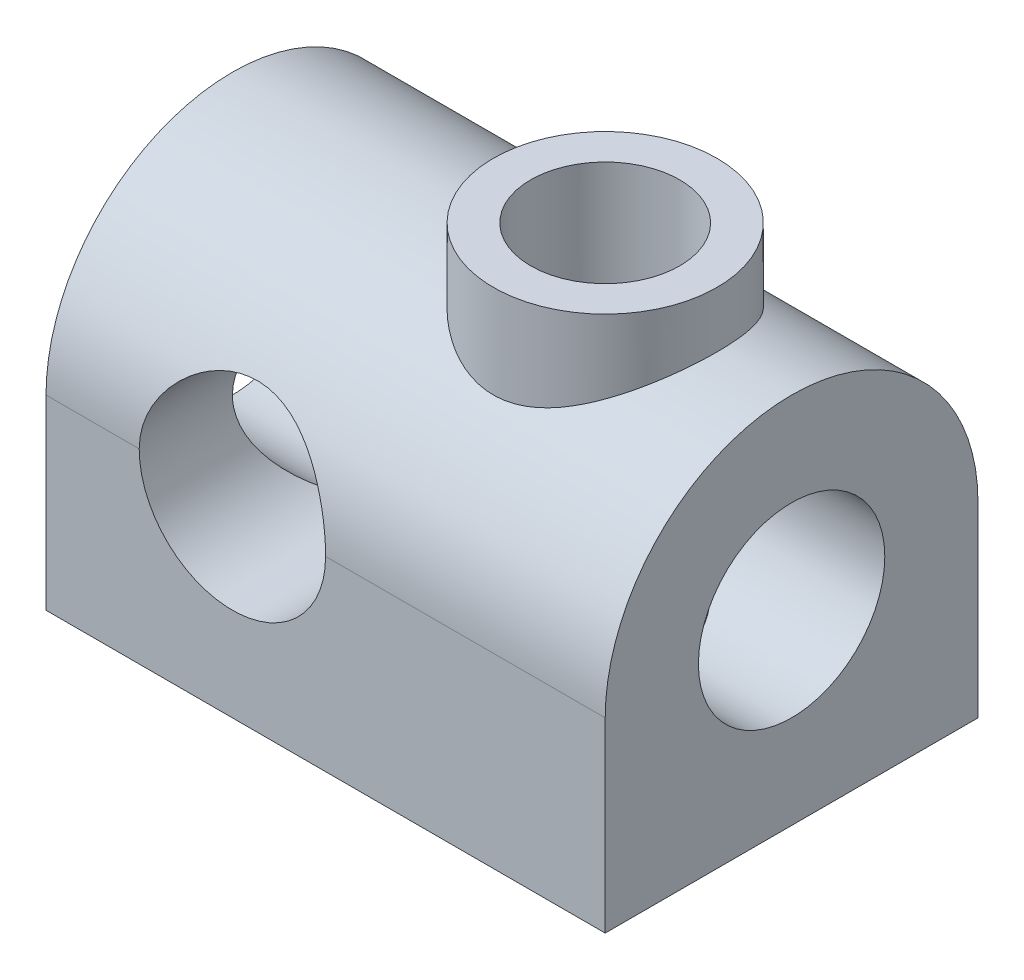
from build123d import *

# Parameters (mm, degrees)
EXTRUDE_1_DEPTH     = 60
SKETCH_3_R          = 12
EXTRUDE_2_DEPTH     = 46
SKETCH_6_R          = 10
CUT_EXTRUDE_1_DEPTH = 69.381284144
SKETCH_7_R          = 8
CUT_EXTRUDE_2_DEPTH = 79.204859286
SKETCH_8_R          = 10
CUT_EXTRUDE_3_DEPTH = 77.655071751


with BuildPart() as part:
    # 草图1 → 凸台-拉伸1 (new body)
    with BuildSketch(Plane(origin=(0, 0, 0), x_dir=(0, 0, -1), z_dir=(1, 0, 0))):
        with BuildLine():
            Line((-20, 0), (-20, -20))
            Line((-20, -20), (20, -20))
            Line((20, -20), (20, 0))
            ThreePointArc((20, 0), (0, 20), (-20, 0))
        make_face()
    extrude(amount=EXTRUDE_1_DEPTH)

    # 草图3 → 凸台-拉伸2 (add)
    with BuildSketch(Plane(origin=(0, -20, 0), x_dir=(-1, 0, 0), z_dir=(0, -1, 0))):
        with Locations(Location((-40, 0, 0), (0, 0, 90))):
            Circle(SKETCH_3_R)
    extrude(amount=-EXTRUDE_2_DEPTH)

    # 草图6 → 切除-拉伸1 (cut, through all)
    with BuildSketch(Plane.ZY):
        Circle(SKETCH_6_R)
    extrude(amount=-CUT_EXTRUDE_1_DEPTH, mode=Mode.SUBTRACT)

    # 草图7 → 切除-拉伸2 (cut, through all)
    with BuildSketch(Plane(origin=(0, 26, 0), x_dir=(1, 0, 0), z_dir=(0, 1, 0))):
        with Locations(Location((40, 0, 0), (0, 0, 270))):
            Circle(SKETCH_7_R)
    extrude(amount=-CUT_EXTRUDE_2_DEPTH, mode=Mode.SUBTRACT)

    # 草图8 → 切除-拉伸3 (cut, through all)
    with BuildSketch(Plane.XY.offset(20)):
        with Locations((20, 0)):
            Circle(SKETCH_8_R)
    extrude(amount=-CUT_EXTRUDE_3_DEPTH, mode=Mode.SUBTRACT)


solid = part.part
